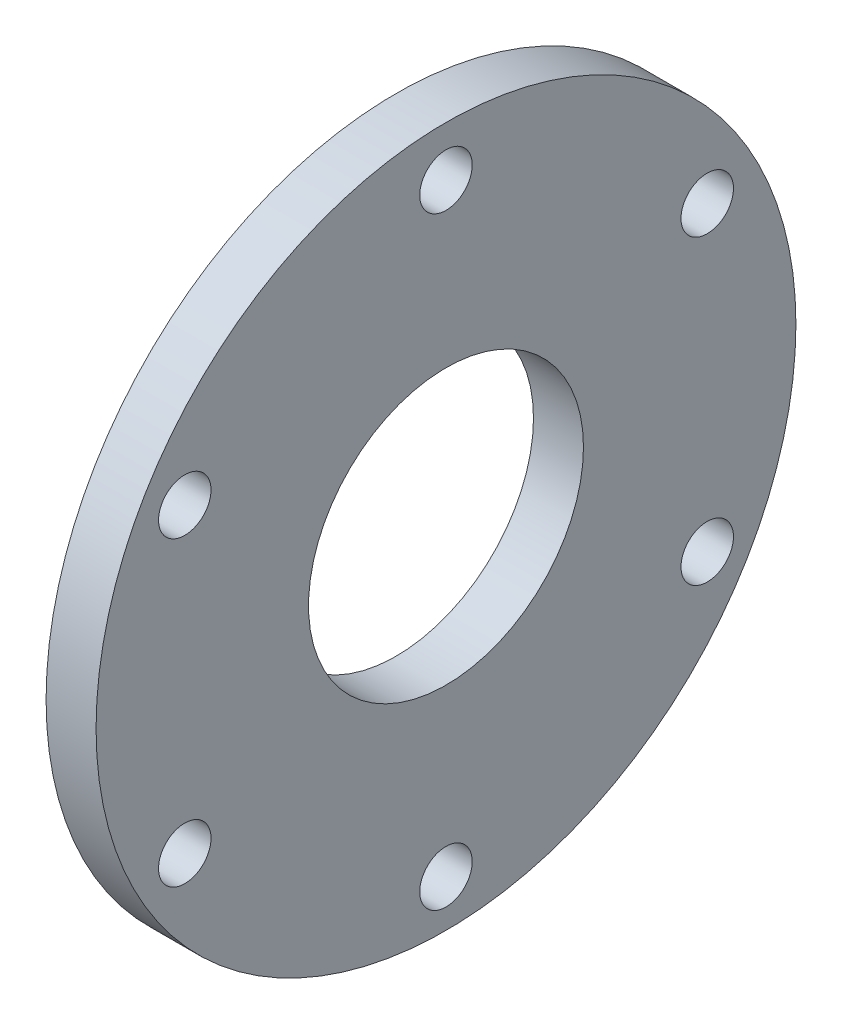
from build123d import *

# Parameters (mm, degrees)
CROQUIS1_R              = 70
SALIENTE_EXTRUIR1_DEPTH = 10
MATRIZC5_COUNT          = 6
CROQUIS9_R              = 27.5
CORTAR_EXTRUIR1_DEPTH   = 10


with BuildPart() as part:
    # Croquis1 → Saliente-Extruir1 (new body)
    with BuildSketch(Plane(origin=(0, 0, 0), x_dir=(0, 0, -1), z_dir=(1, 0, 0))):
        Circle(CROQUIS1_R)
    extrude(amount=SALIENTE_EXTRUIR1_DEPTH)

    # Croquis8 → Taladro roscado M12x1.51 (revolve, cut)
    with BuildSketch(Plane(origin=(10, 60, 0), x_dir=(0, 0, -1), z_dir=(0, 1, 0))):
        Polygon((0, 0), (0, 34.65451825), (5.25, 31.5), (5.25, 0), align=None)
    taladro_roscado_m12x1_51 = revolve(axis=Axis((16.35, 60, 0), (-1, 0, 0)), mode=Mode.SUBTRACT)

    # MatrizC5: Taladro roscado M12x1.51 ×6 about axis
    matrizc5_axis = Axis((0, -0.339409177, 0), (1, 0, 0))
    for i in range(1, MATRIZC5_COUNT):
        add(taladro_roscado_m12x1_51.rotate(matrizc5_axis, i * 360 / MATRIZC5_COUNT), mode=Mode.SUBTRACT)

    # Croquis9 → Cortar-Extruir1 (cut)
    with BuildSketch(Plane(origin=(10, 0, 0), x_dir=(0, 0, -1), z_dir=(1, 0, 0))):
        Circle(CROQUIS9_R)
    extrude(amount=-CORTAR_EXTRUIR1_DEPTH, mode=Mode.SUBTRACT)


solid = part.part
